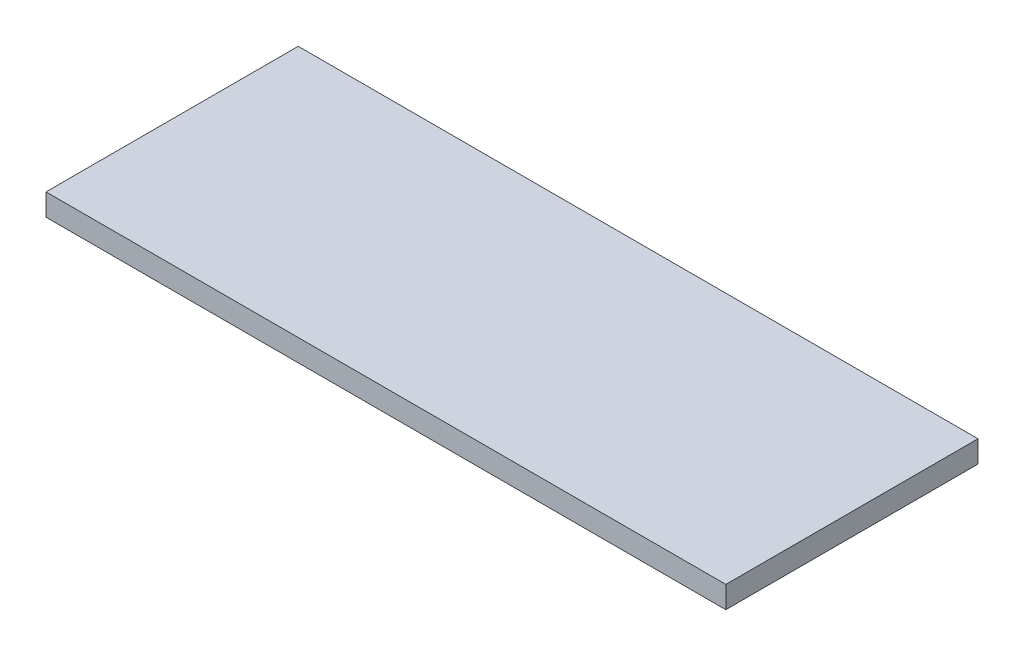
from build123d import *

# Parameters (mm, degrees)
SKETCH1_W           = 310
SKETCH1_H           = 115
BOSS_EXTRUDE1_DEPTH = 10


with BuildPart() as part:
    # Sketch1 → Boss-Extrude1 (new body)
    with BuildSketch(Plane(origin=(0, 0, 0), x_dir=(1, 0, 0), z_dir=(0, 1, 0))):
        with Locations((155, 57.5)):
            Rectangle(SKETCH1_W, SKETCH1_H)
    extrude(amount=BOSS_EXTRUDE1_DEPTH)


solid = part.part
